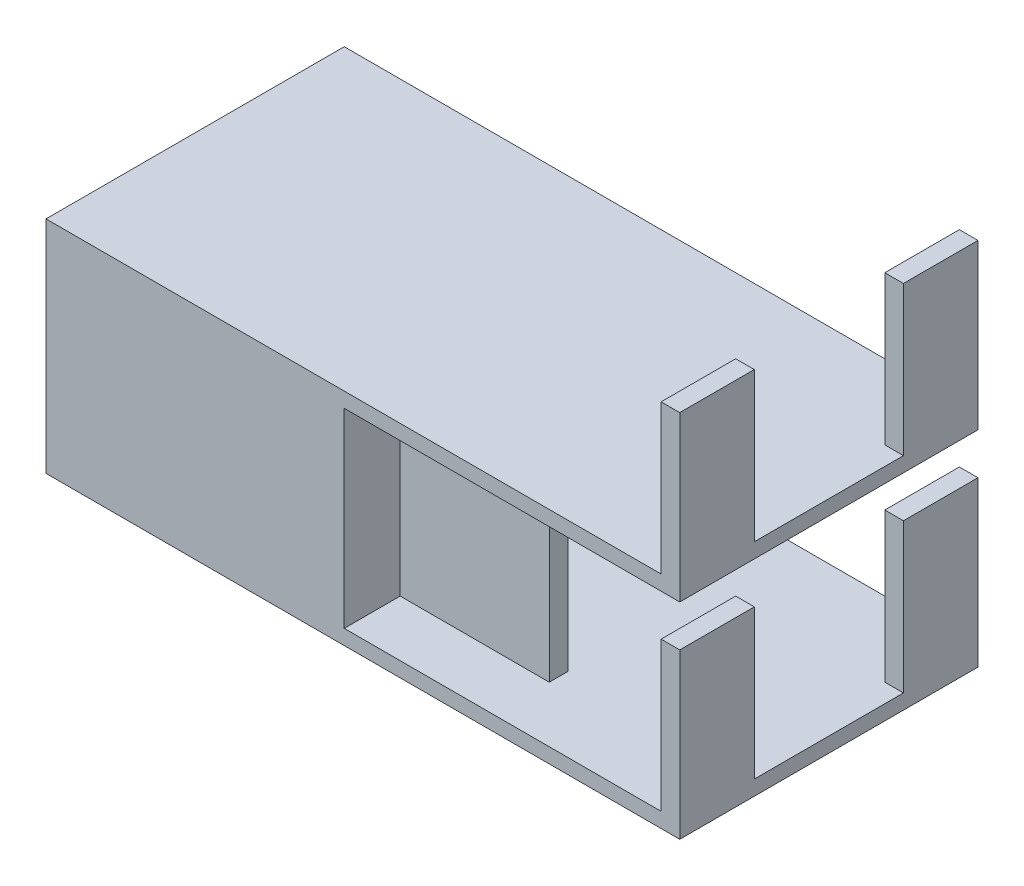
from build123d import *

# Parameters (mm, degrees)
SKETCH1_W            = 50.8
SKETCH1_H            = 50.8
BOSS_EXTRUDE1_DEPTH  = 2.54
SKETCH2_R            = 19.05
CUT_EXTRUDE1_DEPTH   = 37.010715072
SKETCH3_R            = 1.905
CUT_EXTRUDE2_DEPTH   = 37.010715072
SKETCH4_W            = 21.59
SKETCH4_H            = 9.70380699
CUT_EXTRUDE3_DEPTH   = 37.010715072
SKETCH5_W            = 3.175
SKETCH5_H            = 19.05
BOSS_EXTRUDE2_DEPTH  = 35.005772
SKETCH6_W            = 50.8
SKETCH6_H            = 50.8
BOSS_EXTRUDE3_DEPTH  = 2.54
SKETCH8_W            = 50.8
SKETCH8_H            = 37.545772
BOSS_EXTRUDE4_DEPTH  = 2.54
SKETCH9_R            = 3.048
BOSS_EXTRUDE5_DEPTH  = 5.08
CUT_EXTRUDE4_REACH   = 53.962
SKETCH10_W           = 22.86
SKETCH10_H           = 10.16
SKETCH13_W           = 50.8
SKETCH13_H           = 2.54
BOSS_EXTRUDE7_DEPTH  = 57.15
SKETCH15_W           = 3.175
SKETCH15_H           = 12.7
BOSS_EXTRUDE8_DEPTH  = 25.4
SKETCH17_W           = 3.175
SKETCH17_H           = 12.7
BOSS_EXTRUDE10_DEPTH = 25.4
SKETCH18_W           = 3.175
SKETCH18_H           = 32.465772
BOSS_EXTRUDE11_DEPTH = 25.4


with BuildPart() as part:
    # Sketch1 → Boss-Extrude1 (new body)
    with BuildSketch(Plane(origin=(0, 0, 0), x_dir=(1, 0, 0), z_dir=(0, 1, 0))):
        Rectangle(SKETCH1_W, SKETCH1_H)
    extrude(amount=BOSS_EXTRUDE1_DEPTH)

    # Sketch2 → Cut-Extrude1 (cut, through all)
    with BuildSketch(Plane(origin=(0, 2.54, 0), x_dir=(1, 0, 0), z_dir=(0, 1, 0))):
        with Locations(Location((0, 0, 0), (0, 0, 270))):
            Circle(SKETCH2_R)
    extrude(amount=-CUT_EXTRUDE1_DEPTH, mode=Mode.SUBTRACT)

    # Sketch3 → Cut-Extrude2 (cut, through all)
    with BuildSketch(Plane(origin=(0, 2.54, 0), x_dir=(1, 0, 0), z_dir=(0, 1, 0))):
        with Locations(Location((-15.494, 15.494, 0), (0, 0, 270))):
            Circle(SKETCH3_R)
        with Locations(Location((15.494, 15.494, 0), (0, 0, 270))):
            Circle(SKETCH3_R)
        with Locations(Location((15.494, -15.494, 0), (0, 0, 270))):
            Circle(SKETCH3_R)
        with Locations(Location((-15.494, -15.494, 0), (0, 0, 270))):
            Circle(SKETCH3_R)
    extrude(amount=-CUT_EXTRUDE2_DEPTH, mode=Mode.SUBTRACT)

    # Sketch4 → Cut-Extrude3 (cut, through all)
    with BuildSketch(Plane(origin=(0, 2.54, 0), x_dir=(1, 0, 0), z_dir=(0, 1, 0))):
        with Locations((0, -20.548096505)):
            Rectangle(SKETCH4_W, SKETCH4_H)
    extrude(amount=-CUT_EXTRUDE3_DEPTH, mode=Mode.SUBTRACT)

    # Sketch5 → Boss-Extrude2 (add)
    with BuildSketch(Plane(origin=(0, 2.54, 0), x_dir=(1, 0, 0), z_dir=(0, 1, 0))):
        with Locations((-23.8125, -15.875)):
            Rectangle(SKETCH5_W, SKETCH5_H)
        with Locations((23.8125, -15.875)):
            Rectangle(SKETCH5_W, SKETCH5_H)
    extrude(amount=BOSS_EXTRUDE2_DEPTH)

    # Sketch6 → Boss-Extrude3 (add)
    with BuildSketch(Plane(origin=(0, 37.545772, 0), x_dir=(1, 0, 0), z_dir=(0, 1, 0))):
        Rectangle(SKETCH6_W, SKETCH6_H)
    extrude(amount=-BOSS_EXTRUDE3_DEPTH)

    # Sketch8 → Boss-Extrude4 (add)
    with BuildSketch(Plane.XY.offset(25.4)):
        with Locations((0, 18.772886)):
            Rectangle(SKETCH8_W, SKETCH8_H)
    extrude(amount=-BOSS_EXTRUDE4_DEPTH)

    # Sketch9 → Boss-Extrude5 (add)
    with BuildSketch(Plane.XZ.offset(-35.005772)):
        with Locations(Location((0, 0, 0), (0, 0, 270))):
            Circle(SKETCH9_R)
    extrude(amount=BOSS_EXTRUDE5_DEPTH)

    # Sketch10 → Cut-Extrude4 (cut, up to next)
    with BuildSketch(Plane.XZ, mode=Mode.PRIVATE) as cut_extrude4_sk1:
        with Locations((0, -20.32)):
            Rectangle(SKETCH10_W, SKETCH10_H)
    cut_extrude4_tool1 = extrude(cut_extrude4_sk1.sketch, amount=-CUT_EXTRUDE4_REACH, mode=Mode.PRIVATE) & part.part
    add(cut_extrude4_tool1.solids().sort_by_distance((0, 0, -20.32))[0], mode=Mode.SUBTRACT)

    # Sketch13 → Boss-Extrude7 (add)
    with BuildSketch(Plane(origin=(25.4, 0, 0), x_dir=(0, 0, -1), z_dir=(1, 0, 0))):
        with Locations((0, 36.275772)):
            Rectangle(SKETCH13_W, SKETCH13_H)
        with Locations((0, 1.27)):
            Rectangle(SKETCH13_W, SKETCH13_H)
    extrude(amount=BOSS_EXTRUDE7_DEPTH)

    # Sketch15 → Boss-Extrude8 (add)
    with BuildSketch(Plane(origin=(0, 37.545772, 0), x_dir=(1, 0, 0), z_dir=(0, 1, 0))):
        with Locations((80.9625, 19.05)):
            Rectangle(SKETCH15_W, SKETCH15_H)
        with Locations((80.9625, -19.05)):
            Rectangle(SKETCH15_W, SKETCH15_H)
    extrude(amount=BOSS_EXTRUDE8_DEPTH)

    # Sketch17 → Boss-Extrude10 (add)
    with BuildSketch(Plane(origin=(0, 2.54, 0), x_dir=(1, 0, 0), z_dir=(0, 1, 0))):
        with Locations((80.9625, -19.05)):
            Rectangle(SKETCH17_W, SKETCH17_H)
        with Locations((80.9625, 19.05)):
            Rectangle(SKETCH17_W, SKETCH17_H)
    extrude(amount=BOSS_EXTRUDE10_DEPTH)

    # Sketch18 → Boss-Extrude11 (add)
    with BuildSketch(Plane(origin=(25.4, 0, 0), x_dir=(0, 0, -1), z_dir=(1, 0, 0))):
        with Locations((-14.2875, 18.772886)):
            Rectangle(SKETCH18_W, SKETCH18_H)
    extrude(amount=BOSS_EXTRUDE11_DEPTH)


solid = part.part
